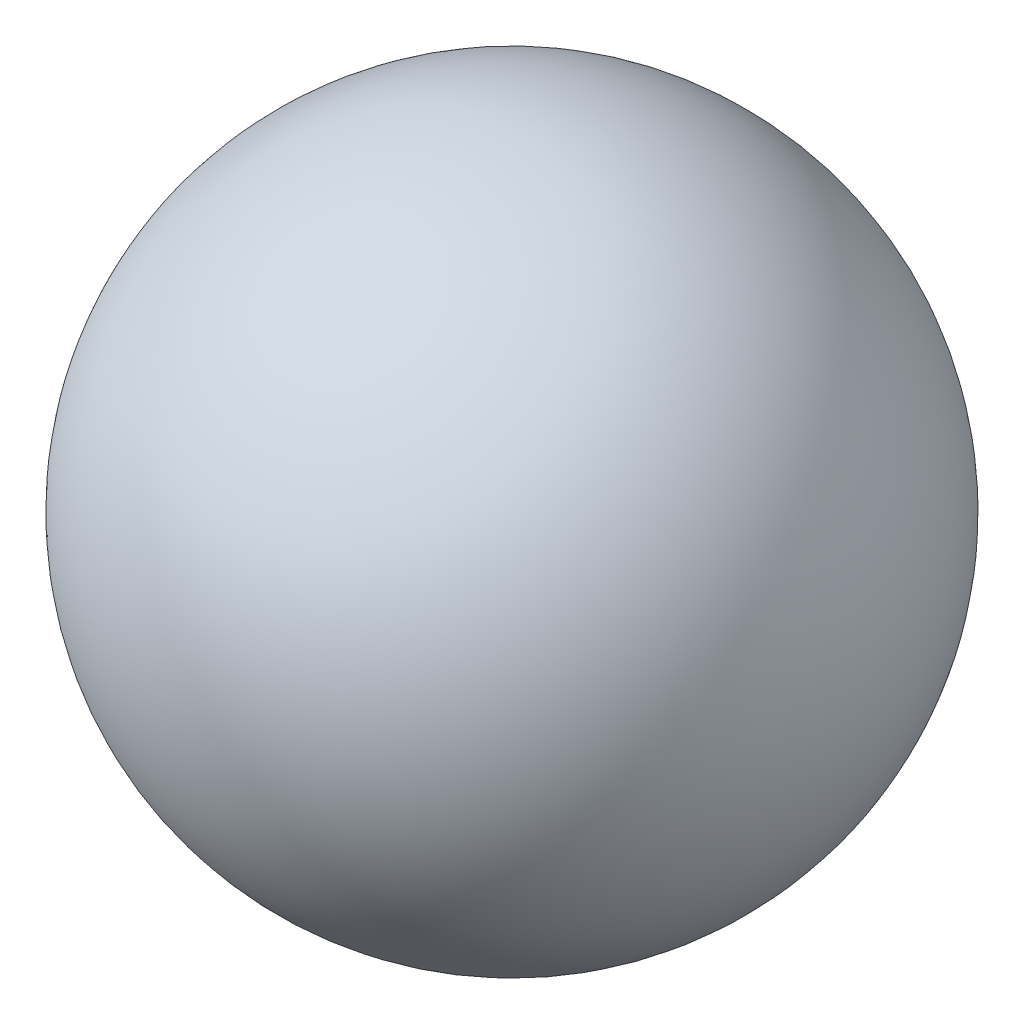
from build123d import *


with BuildPart() as part:
    # Sketch2 → Revolve1 (revolve)
    with BuildSketch(Plane.XY):
        with BuildLine():
            Line((-12, 0), (12, 0))
            ThreePointArc((12, 0), (0, -12), (-12, 0))
        make_face()
    revolve(axis=Axis((-12, 0, 0), (1, 0, 0)))


solid = part.part
